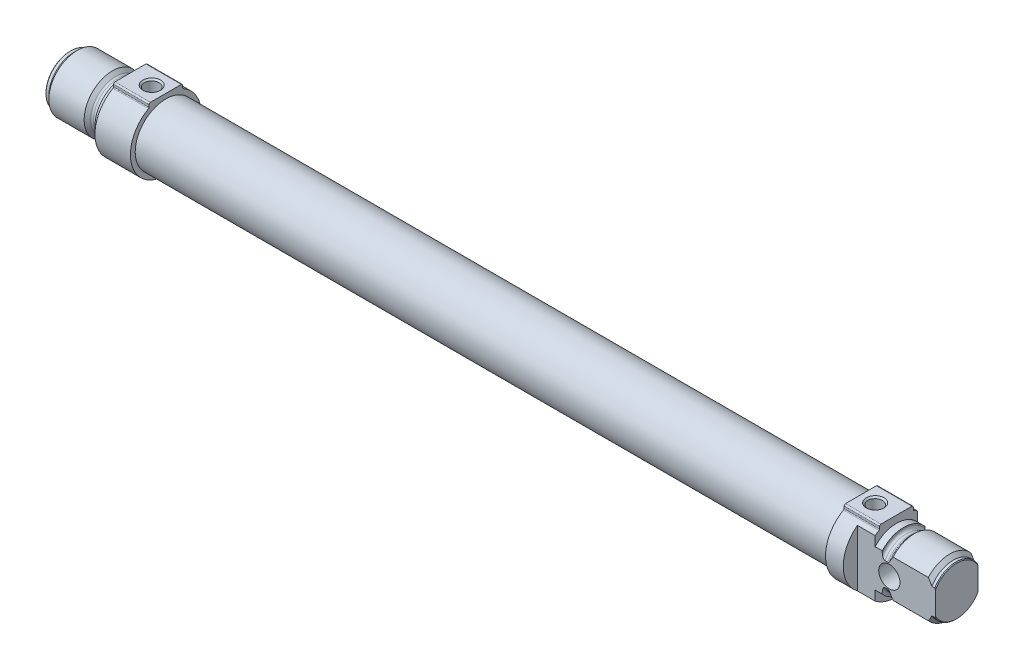
from build123d import *

# Parameters (mm, degrees)
AUFSATZ_LINEAR_AUSTRAGEN1_DEPTH      = 10
SCHNITT_LINEAR_START                 = -0.7
SCHNITT_LINEAR_AUSTRAGEN1_DEPTH      = 0.7
SKIZZE5_W                            = 196
SKIZZE5_H                            = 8.65
AUFSATZ_LINEAR_AUSTRAGEN2_DEPTH      = 10
SCHNITT_LINEAR_AUSTRAGEN2_DEPTH      = 0.7
SCHNITT_LINEAR_AUSTRAGEN3_DEPTH      = 10
SCHNITT_LINEAR_AUSTRAGEN3_DEPTH_BACK = 10
BOHRUNG1_D                           = 6
BOHRUNG2_D                           = 4.134
BOHRUNG2_DEPTH                       = 10
BOHRUNG2_CSINK_D                     = 5
BOHRUNG2_CSINK_ANGLE                 = 90
BOHRUNG3_D                           = 4.134
BOHRUNG3_DEPTH                       = 10
BOHRUNG3_CSINK_D                     = 5
BOHRUNG3_CSINK_ANGLE                 = 90


with BuildPart() as part:
    # Skizze1 → Rotation1 (revolve)
    with BuildSketch(Plane.XY):
        with BuildLine():
            Line((0, 0), (0, 6.8))
            Line((0, 6.8), (0.2, 7))
            Line((0.2, 7), (1, 7))
            Line((1, 7), (2, 8))
            Line((2, 8), (11.95, 8))
            Line((11.95, 8), (12.865685425, 7.084314575))
            ThreePointArc((12.865685425, 7.084314575), (13.125224104, 6.910896374), (13.43137085, 6.85))
            Line((13.43137085, 6.85), (14.2, 6.85))
            ThreePointArc((14.2, 6.85), (14.765685425, 7.084314575), (15, 7.65))
            Line((15, 7.65), (15, 8))
            Line((15, 8), (17, 8))
            Line((17, 8), (17, 0))
            Line((17, 0), (0, 0))
        make_face()
    revolve(axis=Axis((17, 0, 0), (-1, 0, 0)))

    # Skizze2 → Aufsatz-Linear austragen1 (add)
    with BuildSketch(Plane(origin=(17, 0, 0), x_dir=(0, 0, -1), z_dir=(1, 0, 0))):
        with BuildLine():
            Line((4.75, 8.977054082), (4.75, 9.6))
            ThreePointArc((4.75, 9.6), (4.632842712, 9.882842712), (4.35, 10))
            Line((4.35, 10), (-4.35, 10))
            ThreePointArc((-4.35, 10), (-4.632842712, 9.882842712), (-4.75, 9.6))
            Line((-4.75, 9.6), (-4.75, 8.977054082))
            ThreePointArc((-4.75, 8.977054082), (-4.791034545, 8.825604773), (-4.902912621, 8.715586488))
            ThreePointArc((-4.902912621, 8.715586488), (0, -10), (4.902912621, 8.715586488))
            ThreePointArc((4.902912621, 8.715586488), (4.791034545, 8.825604773), (4.75, 8.977054082))
        make_face()
    extrude(amount=AUFSATZ_LINEAR_AUSTRAGEN1_DEPTH)

    # Skizze3 → Schnitt-Rotation1 (revolve, cut)
    with BuildSketch(Plane(origin=(23, 0, 0), x_dir=(0, 0, -1), z_dir=(1, 0, 0))):
        Polygon((6.5, 9.5), (8.25, 9.5), (8.25, 5.4), (8, 5.4), (8, 5.3), (7.8, 5.5), (6.5, 5.5), align=None)
    revolve(axis=Axis((23, 5.5, -6.5), (0, 1, 0)), mode=Mode.SUBTRACT)

    # Skizze4 → Schnitt-Linear austragen1 (cut)
    with BuildSketch(Plane(origin=(0, 5.5, 0), x_dir=(1, 0, 0), z_dir=(0, 1, 0)).offset(SCHNITT_LINEAR_START)):
        with BuildLine():
            Line((23.3, 5.030306154), (23.3, 7.969693846))
            ThreePointArc((23.3, 7.969693846), (23, 8), (22.7, 7.969693846))
            Line((22.7, 7.969693846), (22.7, 5.030306154))
            ThreePointArc((22.7, 5.030306154), (23, 5), (23.3, 5.030306154))
        make_face()
    extrude(amount=SCHNITT_LINEAR_AUSTRAGEN1_DEPTH, mode=Mode.SUBTRACT)

    # Skizze5 → Rotation2 (revolve)
    with BuildSketch(Plane.XY):
        with Locations((125, 4.325)):
            Rectangle(SKIZZE5_W, SKIZZE5_H)
    revolve(axis=Axis((223, 0, 0), (-1, 0, 0)))

    # Skizze6 → Aufsatz-Linear austragen2 (add)
    with BuildSketch(Plane(origin=(223, 0, 0), x_dir=(0, 0, -1), z_dir=(1, 0, 0))):
        with BuildLine():
            Line((4.75, 8.977054082), (4.75, 9.6))
            ThreePointArc((4.75, 9.6), (4.632842712, 9.882842712), (4.35, 10))
            Line((4.35, 10), (-4.35, 10))
            ThreePointArc((-4.35, 10), (-4.632842712, 9.882842712), (-4.75, 9.6))
            Line((-4.75, 9.6), (-4.75, 8.977054082))
            ThreePointArc((-4.75, 8.977054082), (-4.791034545, 8.825604773), (-4.902912621, 8.715586488))
            ThreePointArc((-4.902912621, 8.715586488), (0, -10), (4.902912621, 8.715586488))
            ThreePointArc((4.902912621, 8.715586488), (4.791034545, 8.825604773), (4.75, 8.977054082))
        make_face()
    extrude(amount=AUFSATZ_LINEAR_AUSTRAGEN2_DEPTH)

    # Skizze7 → Schnitt-Rotation2 (revolve, cut)
    with BuildSketch(Plane(origin=(225.35, 0, 0), x_dir=(0, 0, -1), z_dir=(1, 0, 0))):
        Polygon((6.5, 9.5), (8.25, 9.5), (8.25, 5.4), (8, 5.4), (8, 5.3), (7.8, 5.5), (6.5, 5.5), align=None)
    revolve(axis=Axis((225.35, 5.5, -6.5), (0, 1, 0)), mode=Mode.SUBTRACT)

    # Skizze8 → Schnitt-Linear austragen2 (cut)
    with BuildSketch(Plane(origin=(0, 5.5, 0), x_dir=(1, 0, 0), z_dir=(0, 1, 0)).offset(SCHNITT_LINEAR_START)):
        with BuildLine():
            Line((225.65, 5.030306154), (225.65, 7.969693846))
            ThreePointArc((225.65, 7.969693846), (225.35, 8), (225.05, 7.969693846))
            Line((225.05, 7.969693846), (225.05, 5.030306154))
            ThreePointArc((225.05, 5.030306154), (225.35, 5), (225.65, 5.030306154))
        make_face()
    extrude(amount=SCHNITT_LINEAR_AUSTRAGEN2_DEPTH, mode=Mode.SUBTRACT)

    # Skizze9 → Rotation3 (revolve)
    with BuildSketch(Plane.XY):
        with BuildLine():
            Line((233, 0), (233, 8))
            Line((233, 8), (235, 8))
            Line((235, 8), (235, 7.65))
            ThreePointArc((235, 7.65), (235.234314575, 7.084314575), (235.8, 6.85))
            Line((235.8, 6.85), (236.56862915, 6.85))
            ThreePointArc((236.56862915, 6.85), (236.874775896, 6.910896374), (237.134314575, 7.084314575))
            Line((237.134314575, 7.084314575), (238.05, 8))
            Line((238.05, 8), (248, 8))
            Line((248, 8), (249, 7))
            Line((249, 7), (249.8, 7))
            Line((249.8, 7), (250, 6.8))
            Line((250, 6.8), (250, 0))
            Line((250, 0), (233, 0))
        make_face()
    revolve(axis=Axis((250, 0, 0), (-1, 0, 0)))

    # Skizze10 → Schnitt-Linear austragen3 (cut, two sides: drawn at the far end of the back side and taken through both)
    with BuildSketch(Plane(origin=(0, 0, 0), x_dir=(1, 0, 0), z_dir=(0, 1, 0)).offset(-SCHNITT_LINEAR_AUSTRAGEN3_DEPTH_BACK)):
        Polygon((228, 18), (228, 6), (250, 6), (250, -6), (228, -6), (228, -18), (262, -18), (262, 18), align=None)
    extrude(amount=SCHNITT_LINEAR_AUSTRAGEN3_DEPTH + SCHNITT_LINEAR_AUSTRAGEN3_DEPTH_BACK, mode=Mode.SUBTRACT)

    # Bohrung1 (through all)
    with Locations(Plane(origin=(0, 0, -6), x_dir=(-1, 0, 0), z_dir=(0, 0, -1))):
        with Locations((-237, 0)):
            Hole(BOHRUNG1_D / 2)

    # Bohrung2
    with Locations(Plane(origin=(0, 10, 0), x_dir=(1, 0, 0), z_dir=(0, 1, 0))):
        with Locations((23, 0)):
            CounterSinkHole(BOHRUNG2_D / 2, BOHRUNG2_CSINK_D / 2, depth=BOHRUNG2_DEPTH, counter_sink_angle=BOHRUNG2_CSINK_ANGLE)

    # Bohrung3
    with Locations(Plane(origin=(0, 10, 0), x_dir=(1, 0, 0), z_dir=(0, 1, 0))):
        with Locations((227, 0)):
            CounterSinkHole(BOHRUNG3_D / 2, BOHRUNG3_CSINK_D / 2, depth=BOHRUNG3_DEPTH, counter_sink_angle=BOHRUNG3_CSINK_ANGLE)

    # Skizze17 → Schnitt-Rotation3 (revolve, cut)
    with BuildSketch(Plane.XY):
        Polygon((-5, 0), (-5, 3), (41.2, 3), (41.2, 8), (205.2, 8), (205.2, 0), align=None)
    revolve(axis=Axis((205.2, 0, 0), (-1, 0, 0)), mode=Mode.SUBTRACT)


solid = part.part
